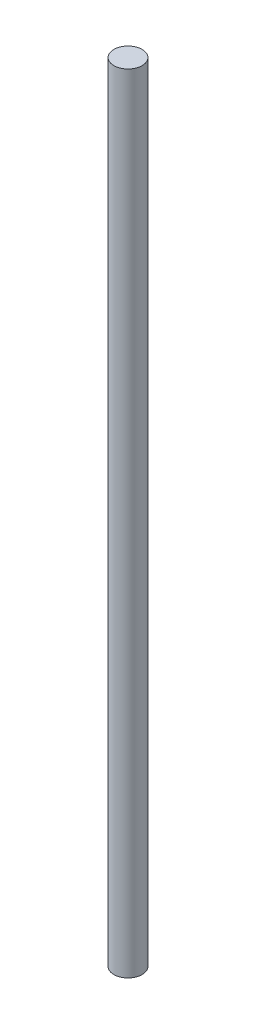
from build123d import *

# Parameters (mm, degrees)
SKETCH1_R           = 6
BOSS_EXTRUDE1_DEPTH = 335


with BuildPart() as part:
    # Sketch1 → Boss-Extrude1 (new body)
    with BuildSketch(Plane(origin=(0, 0, 0), x_dir=(1, 0, 0), z_dir=(0, 1, 0))):
        with Locations(Location((0, 0, 0), (0, 0, 270))):
            Circle(SKETCH1_R)
    extrude(amount=BOSS_EXTRUDE1_DEPTH)


solid = part.part
